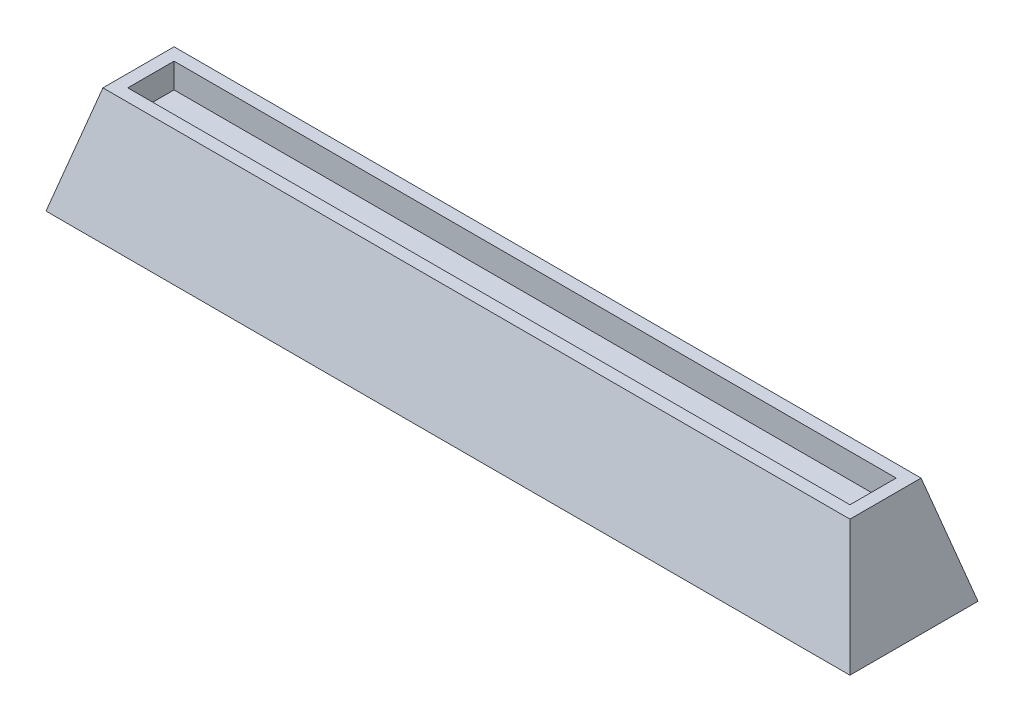
from build123d import *

# Parameters (mm, degrees)
SKETCH_3_W          = 101.5
SKETCH_3_H          = 6.5
CUT_EXTRUDE_1_DEPTH = 3.5
SKETCH_4_W          = 2.906517827
SKETCH_4_H          = 2.452374416
SKETCH_4_W_2        = 2.906517826
SKETCH_4_W_3        = 6.902979839
SKETCH_4_H_2        = 7.084637203
SKETCH_4_W_4        = 2.724860462
SKETCH_4_H_3        = 1.544087595
SKETCH_4_W_5        = 2.724860463
SKETCH_4_H_4        = 1.634916278
CUT_EXTRUDE_2_DEPTH = 1.5


with BuildPart() as part:
    # 草图2 → 放样1 section 0
    with BuildSketch(Plane(origin=(0, -15, 0), x_dir=(1, 0, 0), z_dir=(0, 1, 0))):
        with BuildLine():
            Line((-60.339861751, 19.934331797), (52.660138249, 19.934331797))
            Line((52.660138249, 19.934331797), (52.660138249, 1.934331797))
            Line((52.660138249, 1.934331797), (-60.339861751, 1.934331797))
            Line((-60.339861751, 1.934331797), (-60.339861751, 19.934331797))
        make_face()
    # 草图1 → 放样1 section 1
    with BuildSketch(Plane(origin=(0, 0, 0), x_dir=(1, 0, 0), z_dir=(0, 1, 0))):
        with BuildLine():
            Line((-56.339861751, 15.934331797), (48.660138249, 15.934331797))
            Line((48.660138249, 15.934331797), (48.660138249, 5.934331797))
            Line((48.660138249, 5.934331797), (-56.339861751, 5.934331797))
            Line((-56.339861751, 5.934331797), (-56.339861751, 15.934331797))
        make_face()
    loft()

    # 草图3 → 切除-拉伸1 (cut)
    with BuildSketch(Plane(origin=(0, 0, 0), x_dir=(1, 0, 0), z_dir=(0, 1, 0))):
        with Locations((-3.839861751, 10.934331797)):
            Rectangle(SKETCH_3_W, SKETCH_3_H)
    extrude(amount=-CUT_EXTRUDE_1_DEPTH, mode=Mode.SUBTRACT)

    # 草图4 → 切除-拉伸2 (cut)
    # profile 1 of 17: a face of its own
    with BuildSketch(Plane(origin=(0, 3.967053559, -14.876450848), x_dir=(-1, 0, 0), z_dir=(0, 0.2576626505603324, -0.9662349396012463))):
        Polygon((-29.67592194, -9.348412753), (-25.951945975, -9.348412753), (-25.951945975, -7.259353065), (-25.134487836, -7.259353065), (-25.134487836, -9.348412753), (-21.41051187, -9.348412753), (-21.41051187, -13.799018176), (-22.227970009, -13.799018176), (-22.227970009, -13.254046083), (-25.134487836, -13.254046083), (-25.134487836, -16.796364685), (-25.951945975, -16.796364685), (-25.951945975, -13.254046083), (-28.858463801, -13.254046083), (-28.858463801, -13.799018176), (-29.67592194, -13.799018176), align=None)
        with Locations((-23.681228923, -11.301229418)):
            Rectangle(SKETCH_4_W, SKETCH_4_H, mode=Mode.SUBTRACT)
        with Locations((-27.405204888, -11.301229418)):
            Rectangle(SKETCH_4_W_2, SKETCH_4_H, mode=Mode.SUBTRACT)
    # profile 2 of 17: a face of its own
    with BuildSketch(Plane(origin=(0, 3.967053559, -14.876450848), x_dir=(-1, 0, 0), z_dir=(0, 0.2576626505603324, -0.9662349396012463))):
        Polygon((-19.957252957, -7.804325158), (-11.601014204, -7.804325158), (-11.601014204, -16.614707321), (-12.327643661, -16.614707321), (-12.327643661, -16.16056391), (-19.2306235, -16.16056391), (-19.2306235, -16.614707321), (-19.957252957, -16.614707321), align=None)
        with Locations((-15.779133581, -11.982444534)):
            Rectangle(SKETCH_4_W_3, SKETCH_4_H_2, mode=Mode.SUBTRACT)
    # profile 3 of 17: a face of its own
    with BuildSketch(Plane(origin=(0, 3.967053559, -14.876450848), x_dir=(-1, 0, 0), z_dir=(0, 0.2576626505603324, -0.9662349396012463))):
        Polygon((-18.776480089, -13.889846858), (-16.142448309, -13.889846858), (-16.142448309, -11.982444534), (-18.413165361, -11.982444534), (-18.413165361, -11.346643759), (-16.142448309, -11.346643759), (-16.142448309, -10.07504221), (-18.594822725, -10.07504221), (-18.594822725, -9.439241435), (-12.963444436, -9.439241435), (-12.963444436, -10.07504221), (-15.415818852, -10.07504221), (-15.415818852, -11.346643759), (-13.1451018, -11.346643759), (-13.1451018, -11.982444534), (-15.415818852, -11.982444534), (-15.415818852, -13.889846858), (-12.781787071, -13.889846858), (-12.781787071, -14.525647632), (-18.776480089, -14.525647632), align=None)
    # profile 4 of 17: a face of its own
    with BuildSketch(Plane(origin=(0, 3.967053559, -14.876450848), x_dir=(-1, 0, 0), z_dir=(0, 0.2576626505603324, -0.9662349396012463))):
        with BuildLine():
            Line((-14.961675442, -12.565734977), (-14.43941052, -12.164101898))
            add(Edge.make_bspline(
                [(-14.43941052, -12.164101898), (-14.351443691, -12.253078167), (-14.180171082, -12.42631617), (-13.937666239, -12.686342529), (-13.713991127, -12.936975542), (-13.57556731, -13.104605567), (-13.508416528, -13.185924572)],
                knots=[0, 0, 0, 0, 1.085639139, 2.113754135, 3.084963225, 4, 4, 4, 4], degree=3))
            Line((-13.508416528, -13.185924572), (-14.03068145, -13.617360812))
            add(Edge.make_bspline(
                [(-14.03068145, -13.617360812), (-14.110939355, -13.517017122), (-14.266424604, -13.322619278), (-14.503248709, -13.048206293), (-14.731891605, -12.796468149), (-14.886837014, -12.640882594), (-14.961675442, -12.565734977)],
                knots=[0, 0, 0, 0, 1.097044506, 2.125326337, 3.094535107, 4, 4, 4, 4], degree=3))
        make_face()
    # profile 5 of 17: a face of its own
    with BuildSketch(Plane(origin=(0, 3.967053559, -14.876450848), x_dir=(-1, 0, 0), z_dir=(0, 0.2576626505603324, -0.9662349396012463))):
        Polygon((-10.692727383, -15.343105771), (-7.604552192, -15.343105771), (-7.604552192, -7.441010429), (-6.787094053, -7.441010429), (-6.787094053, -15.343105771), (-5.061349094, -15.343105771), (-5.061349094, -7.441010429), (-4.243890955, -7.441010429), (-4.243890955, -15.343105771), (-1.246544446, -15.343105771), (-1.246544446, -16.069735228), (-10.692727383, -16.069735228), align=None)
    # profile 6 of 17: a face of its own
    with BuildSketch(Plane(origin=(0, 3.967053559, -14.876450848), x_dir=(-1, 0, 0), z_dir=(0, 0.2576626505603324, -0.9662349396012463))):
        with BuildLine():
            add(Edge.make_bspline(
                [(-9.511954516, -9.348412753), (-9.379574416, -9.659799751), (-9.111605353, -10.29012169), (-8.721031097, -11.253707832), (-8.339968954, -12.247642057), (-8.092859406, -12.9216406), (-7.967866921, -13.262561272)],
                knots=[0, 0, 0, 0, 0.964814831, 1.953016539, 2.964598687, 4, 4, 4, 4], degree=3))
            Line((-7.967866921, -13.262561272), (-8.785325059, -13.617360812))
            add(Edge.make_bspline(
                [(-8.785325059, -13.617360812), (-8.895036386, -13.282407054), (-9.114293678, -12.613004396), (-9.469187126, -11.61842817), (-9.841071221, -10.631309602), (-10.106109501, -9.980336431), (-10.238583973, -9.654959555)],
                knots=[0, 0, 0, 0, 1.001847065, 2.002184105, 3.00142875, 4, 4, 4, 4], degree=3))
            Line((-10.238583973, -9.654959555), (-9.511954516, -9.348412753))
        make_face()
    # profile 7 of 17: a face of its own
    with BuildSketch(Plane(origin=(0, 3.967053559, -14.876450848), x_dir=(-1, 0, 0), z_dir=(0, 0.2576626505603324, -0.9662349396012463))):
        with BuildLine():
            add(Edge.make_bspline(
                [(-3.971404909, -13.300879622), (-3.891363397, -13.135573663), (-3.732268647, -12.807002775), (-3.505380424, -12.313062744), (-3.283517141, -11.825124944), (-3.07668777, -11.339466584), (-2.874686702, -10.85995245), (-2.687304914, -10.382583971), (-2.505966974, -9.910535077), (-2.392701005, -9.595559546), (-2.336488631, -9.439241435)],
                knots=[0, 0, 0, 0, 1.050565548, 2.088159765, 3.109163813, 4.11649263, 5.107522664, 6.085386974, 7.049803367, 8, 8, 8, 8], degree=3))
            Line((-2.336488631, -9.439241435), (-1.609859174, -9.745788237))
            add(Edge.make_bspline(
                [(-1.609859174, -9.745788237), (-1.680356565, -9.9304638), (-1.818932898, -10.293479536), (-2.031338929, -10.826098789), (-2.240036194, -11.339156446), (-2.443195009, -11.834167573), (-2.64851267, -12.307206014), (-2.848604455, -12.762043943), (-3.044543099, -13.197672029), (-3.178984281, -13.479461936), (-3.244775452, -13.617360812)],
                knots=[0, 0, 0, 0, 1.128539875, 2.218364625, 3.27359543, 4.290766853, 5.273106292, 6.217546091, 7.127724653, 8, 8, 8, 8], degree=3))
            Line((-3.244775452, -13.617360812), (-3.971404909, -13.300879622))
        make_face()
    # profile 8 of 17: a face of its own
    with BuildSketch(Plane(origin=(0, 3.967053559, -14.876450848), x_dir=(-1, 0, 0), z_dir=(0, 0.2576626505603324, -0.9662349396012463))):
        with BuildLine():
            Line((-0.610743671, -12.436587944), (3.476547023, -12.436587944))
            Line((3.476547023, -12.436587944), (3.476547023, -11.074157713))
            Line((3.476547023, -11.074157713), (1.205829971, -11.074157713))
            Line((1.205829971, -11.074157713), (1.205829971, -10.587372745))
            add(Edge.make_bspline(
                [(1.205829971, -10.587372745), (1.072466882, -10.677100685), (0.802962766, -10.85842559), (0.384886751, -11.118582198), (-0.047589119, -11.375419763), (-0.345288357, -11.537294762), (-0.495788621, -11.619129806)],
                knots=[0, 0, 0, 0, 0.968763999, 1.957707254, 2.967529781, 4, 4, 4, 4], degree=3))
            add(Edge.make_bspline(
                [(-0.495788621, -11.619129806), (-0.530492333, -11.563114504), (-0.60168304, -11.448205501), (-0.71705256, -11.275245328), (-0.841933235, -11.096699574), (-0.92939147, -10.976563681), (-0.9740584, -10.915207519)],
                knots=[0, 0, 0, 0, 0.92881088, 1.90534957, 2.930213894, 4, 4, 4, 4], degree=3))
            add(Edge.make_bspline(
                [(-0.9740584, -10.915207519), (-0.852118313, -10.85345241), (-0.610431587, -10.731053037), (-0.257304362, -10.53691347), (0.085870674, -10.340631088), (0.417318673, -10.13882583), (0.736400325, -9.9314758), (1.044594206, -9.720114929), (1.341290534, -9.504282426), (1.627221136, -9.284429132), (1.90082702, -9.058608588), (2.163635494, -8.828751338), (2.414961964, -8.5944676), (2.655381091, -8.35588172), (2.883799827, -8.112288084), (3.099377004, -7.862759145), (3.306503913, -7.610845029), (3.435171392, -7.436843273), (3.499254193, -7.350181747)],
                knots=[0, 0, 0, 0, 1.135989573, 2.251545074, 3.348852318, 4.42171079, 5.476315166, 6.511306265, 7.527416438, 8.525419603, 9.508627931, 10.475497134, 11.426933218, 12.363886959, 13.290220496, 14.201613547, 15.104314129, 16, 16, 16, 16], degree=3))
            Line((3.499254193, -7.350181747), (4.498369696, -7.350181747))
            Line((4.498369696, -7.350181747), (4.306777945, -7.588607038))
            add(Edge.make_bspline(
                [(4.306777945, -7.588607038), (4.374380606, -7.674179685), (4.50938844, -7.845074995), (4.72094861, -8.093556794), (4.941015465, -8.333619242), (5.170079629, -8.565148986), (5.407248408, -8.789464538), (5.652462196, -9.006792144), (5.906626187, -9.215003023), (6.168565934, -9.416084103), (6.439137729, -9.608320402), (6.717596344, -9.793437338), (7.004896948, -9.969239004), (7.300204, -10.138229931), (7.603494955, -10.299782106), (7.915093546, -10.453789183), (8.235539323, -10.598029605), (8.453438196, -10.688220569), (8.56295322, -10.733550155)],
                knots=[0, 0, 0, 0, 0.977128783, 1.95140307, 2.923461668, 3.894632574, 4.869155811, 5.848140142, 6.829983577, 7.812622778, 8.806534691, 9.803506232, 10.808233629, 11.824032859, 12.85185151, 13.886925924, 14.937978175, 16, 16, 16, 16], degree=3))
            add(Edge.make_bspline(
                [(8.56295322, -10.733550155), (8.514910173, -10.796271286), (8.421583686, -10.918110827), (8.289897743, -11.098948018), (8.167267262, -11.269973385), (8.091508608, -11.382882395), (8.054880279, -11.437472441)],
                knots=[0, 0, 0, 0, 1.091846183, 2.120976395, 3.091516394, 4, 4, 4, 4], degree=3))
            add(Edge.make_bspline(
                [(8.054880279, -11.437472441), (7.916596423, -11.369115003), (7.641618572, -11.233186039), (7.242057812, -11.009271736), (6.850425592, -10.780292949), (6.59902065, -10.614527419), (6.473893532, -10.532024017)],
                knots=[0, 0, 0, 0, 1.015060181, 2.018450131, 3.013759947, 4, 4, 4, 4], degree=3))
            Line((6.473893532, -10.532024017), (6.473893532, -11.074157713))
            Line((6.473893532, -11.074157713), (4.20317648, -11.074157713))
            Line((4.20317648, -11.074157713), (4.20317648, -12.436587944))
            Line((4.20317648, -12.436587944), (8.199638491, -12.436587944))
            Line((8.199638491, -12.436587944), (8.199638491, -13.163217401))
            Line((8.199638491, -13.163217401), (4.20317648, -13.163217401))
            Line((4.20317648, -13.163217401), (4.20317648, -15.381424122))
            add(Edge.make_bspline(
                [(4.20317648, -15.381424122), (4.202684622, -15.434930108), (4.201729063, -15.538879308), (4.185084829, -15.689093638), (4.161769704, -15.829251485), (4.12774199, -15.959014695), (4.083771313, -16.078889906), (4.030170716, -16.188733179), (3.965573188, -16.287672113), (3.891816489, -16.375937953), (3.807802387, -16.453964876), (3.714545043, -16.521849196), (3.610585133, -16.579327924), (3.497235184, -16.625881426), (3.373846924, -16.66119381), (3.241324465, -16.686441831), (3.098943913, -16.702229334), (3.000684942, -16.704411117), (2.950024506, -16.705536003)],
                knots=[0, 0, 0, 0, 1.227352726, 2.384449713, 3.4643955, 4.486231671, 5.458405424, 6.390714832, 7.285141784, 8.163743981, 9.024178394, 9.910262741, 10.804557878, 11.744172713, 12.716588964, 13.745094855, 14.837414293, 16, 16, 16, 16], degree=3))
            add(Edge.make_bspline(
                [(2.950024506, -16.705536003), (2.871022148, -16.705119399), (2.701187433, -16.704223808), (2.427269738, -16.701516739), (2.116458095, -16.695732107), (1.896502947, -16.69006992), (1.780605224, -16.687086427)],
                knots=[0, 0, 0, 0, 0.810572924, 1.742522951, 2.810500907, 4, 4, 4, 4], degree=3))
            add(Edge.make_bspline(
                [(1.780605224, -16.687086427), (1.763212843, -16.560216149), (1.726880165, -16.295184186), (1.682900215, -16.031311834), (1.659973381, -15.893754656)],
                knots=[0, 0, 0, 0, 0.957396055, 2, 2, 2, 2], degree=3))
            add(Edge.make_bspline(
                [(1.659973381, -15.893754656), (1.772523409, -15.90552836), (1.987056532, -15.927970374), (2.294131283, -15.953487078), (2.570442901, -15.971466825), (2.744693492, -15.976528591), (2.826554267, -15.978906546)],
                knots=[0, 0, 0, 0, 1.160595432, 2.212226569, 3.160126127, 4, 4, 4, 4], degree=3))
            add(Edge.make_bspline(
                [(2.826554267, -15.978906546), (2.877312508, -15.978862172), (2.973164862, -15.978778376), (3.108028363, -15.950401355), (3.223706806, -15.899093547), (3.318584893, -15.823419138), (3.39158125, -15.725040017), (3.440764791, -15.604052244), (3.472235946, -15.462499145), (3.475054233, -15.360325789), (3.476547023, -15.306206619)],
                knots=[0, 0, 0, 0, 1.126147397, 2.126627605, 3.039704736, 3.915179211, 4.794435995, 5.732137162, 6.798758716, 8, 8, 8, 8], degree=3))
            Line((3.476547023, -15.306206619), (3.476547023, -13.163217401))
            Line((3.476547023, -13.163217401), (-0.610743671, -13.163217401))
            Line((-0.610743671, -13.163217401), (-0.610743671, -12.436587944))
        make_face()
        with BuildLine():
            add(Edge.make_bspline(
                [(3.844119346, -8.150609508), (3.767393166, -8.248291757), (3.612777925, -8.44513675), (3.362971897, -8.730087185), (3.098899256, -9.011304291), (2.819011285, -9.288625688), (2.522172288, -9.560182466), (2.210908661, -9.829271946), (1.883645205, -10.093346842), (1.655844167, -10.26221652), (1.540760736, -10.347528256)],
                knots=[0, 0, 0, 0, 0.933290205, 1.88072559, 2.846485345, 3.831896886, 4.84082498, 5.869212857, 6.923541795, 8, 8, 8, 8], degree=3))
            Line((1.540760736, -10.347528256), (6.20566508, -10.347528256))
            add(Edge.make_bspline(
                [(6.20566508, -10.347528256), (6.096321706, -10.268300279), (5.877842537, -10.109994731), (5.560268649, -9.859972401), (5.251942278, -9.599792393), (4.952305026, -9.330032308), (4.661266519, -9.050252172), (4.378802299, -8.760938773), (4.105680228, -8.4612789), (3.931436853, -8.254321028), (3.844119346, -8.150609508)],
                knots=[0, 0, 0, 0, 1.001789031, 2.00167625, 2.99802102, 3.994631601, 4.992557832, 5.992845409, 6.994167015, 8, 8, 8, 8], degree=3))
        make_face(mode=Mode.SUBTRACT)
    # profile 9 of 17: a face of its own
    with BuildSketch(Plane(origin=(0, 3.967053559, -14.876450848), x_dir=(-1, 0, 0), z_dir=(0, 0.2576626505603324, -0.9662349396012463))):
        with BuildLine():
            add(Edge.make_bspline(
                [(5.815385587, -13.526532129), (5.938862164, -13.623501628), (6.181803574, -13.814290093), (6.539741663, -14.095628515), (6.881236433, -14.371747447), (7.210263915, -14.638066064), (7.522817305, -14.899588304), (7.822928812, -15.151364127), (8.106556929, -15.397784966), (8.290989117, -15.559241982), (8.381295856, -15.638298988)],
                knots=[0, 0, 0, 0, 1.133684491, 2.230535663, 3.287358962, 4.304735904, 5.287055296, 6.230028982, 7.133338319, 8, 8, 8, 8], degree=3))
            Line((8.381295856, -15.638298988), (7.786651828, -16.251392592))
            add(Edge.make_bspline(
                [(7.786651828, -16.251392592), (7.588871284, -16.062140701), (7.191443714, -15.681850924), (6.575836834, -15.126380283), (5.943579431, -14.577983603), (5.510582907, -14.221936485), (5.293120665, -14.043120259)],
                knots=[0, 0, 0, 0, 0.985869783, 1.981043355, 2.986026876, 4, 4, 4, 4], degree=3))
            Line((5.293120665, -14.043120259), (5.815385587, -13.526532129))
        make_face()
    # profile 10 of 17: a face of its own
    with BuildSketch(Plane(origin=(0, 3.967053559, -14.876450848), x_dir=(-1, 0, 0), z_dir=(0, 0.2576626505603324, -0.9662349396012463))):
        with BuildLine():
            Line((1.410194505, -13.526532129), (2.114116791, -13.986352333))
            add(Edge.make_bspline(
                [(2.114116791, -13.986352333), (2.018107757, -14.10267382), (1.829006006, -14.331783479), (1.541343568, -14.66275273), (1.261706374, -14.981404826), (0.983282975, -15.282676506), (0.711160558, -15.570716771), (0.440291619, -15.841138111), (0.177282716, -16.099643124), (-0.000942309, -16.262320948), (-0.088478749, -16.342221274)],
                knots=[0, 0, 0, 0, 1.121341188, 2.20862114, 3.26015554, 4.273276354, 5.258470736, 6.206048331, 7.118888363, 8, 8, 8, 8], degree=3))
            add(Edge.make_bspline(
                [(-0.088478749, -16.342221274), (-0.133288232, -16.300920383), (-0.225906794, -16.215553874), (-0.372503698, -16.085727436), (-0.532742091, -15.951805367), (-0.644230542, -15.86098907), (-0.701572353, -15.81427956)],
                knots=[0, 0, 0, 0, 0.903625771, 1.867741226, 2.903316182, 4, 4, 4, 4], degree=3))
            add(Edge.make_bspline(
                [(-0.701572353, -15.81427956), (-0.602978709, -15.732265055), (-0.405512702, -15.568004197), (-0.121104871, -15.307416049), (0.156500481, -15.03786188), (0.424238409, -14.756531789), (0.684708381, -14.465485258), (0.935290826, -14.162877623), (1.179178847, -13.850796126), (1.332933104, -13.634979717), (1.410194505, -13.526532129)],
                knots=[0, 0, 0, 0, 0.985364262, 1.973514087, 2.963234022, 3.95828044, 4.957230328, 5.96398113, 6.976902013, 8, 8, 8, 8], degree=3))
        make_face()
    # profile 11 of 17: a face of its own
    with BuildSketch(Plane(origin=(0, 3.967053559, -14.876450848), x_dir=(-1, 0, 0), z_dir=(0, 0.2576626505603324, -0.9662349396012463))):
        with BuildLine():
            Line((8.926267948, -11.074157713), (12.731138209, -11.074157713))
            add(Edge.make_bspline(
                [(12.731138209, -11.074157713), (12.768634038, -10.899965192), (12.845392662, -10.543371448), (12.924297554, -9.988999279), (12.986231399, -9.406349046), (13.004310141, -9.007486095), (13.013558642, -8.803440661)],
                knots=[0, 0, 0, 0, 0.932822433, 1.909603482, 2.930620497, 4, 4, 4, 4], degree=3))
            Line((13.013558642, -8.803440661), (9.743726087, -8.803440661))
            Line((9.743726087, -8.803440661), (9.743726087, -8.076811204))
            Line((9.743726087, -8.076811204), (17.554992747, -8.076811204))
            Line((17.554992747, -8.076811204), (17.554992747, -8.803440661))
            Line((17.554992747, -8.803440661), (13.831016781, -8.803440661))
            add(Edge.make_bspline(
                [(13.831016781, -8.803440661), (13.817032888, -9.007480065), (13.789702054, -9.406265082), (13.722272387, -9.988610505), (13.644651589, -10.542710993), (13.573419229, -10.899879941), (13.538661961, -11.074157713)],
                knots=[0, 0, 0, 0, 1.070909683, 2.093040506, 3.069514149, 4, 4, 4, 4], degree=3))
            Line((13.538661961, -11.074157713), (18.281622204, -11.074157713))
            Line((18.281622204, -11.074157713), (18.281622204, -11.80078717))
            Line((18.281622204, -11.80078717), (13.376873371, -11.80078717))
            add(Edge.make_bspline(
                [(13.376873371, -11.80078717), (13.344184733, -11.933615007), (13.279275221, -12.197369963), (13.158234315, -12.584309314), (13.015962116, -12.95936647), (12.854032566, -13.323327093), (12.672109209, -13.675904579), (12.47012685, -14.0169875), (12.248967389, -14.346788582), (12.005652667, -14.663871095), (11.74570316, -14.972669079), (11.461928738, -15.267037726), (11.160761523, -15.55238335), (10.837989233, -15.823897316), (10.49676258, -16.086295915), (10.134234871, -16.335344787), (9.752526054, -16.574814232), (9.486623688, -16.721907832), (9.352027396, -16.796364685)],
                knots=[0, 0, 0, 0, 0.990483684, 1.966793896, 2.933966559, 3.894050221, 4.850189207, 5.805566789, 6.763373831, 7.724050241, 8.698772232, 9.684986583, 10.68349586, 11.702074788, 12.738151356, 13.79966023, 14.886216846, 16, 16, 16, 16], degree=3))
            add(Edge.make_bspline(
                [(9.352027396, -16.796364685), (9.315603072, -16.746327272), (9.240776064, -16.643534699), (9.116438826, -16.492547304), (8.981884263, -16.337041091), (8.885072127, -16.235386521), (8.835439266, -16.183271081)],
                knots=[0, 0, 0, 0, 0.925364573, 1.9009897, 2.923896413, 4, 4, 4, 4], degree=3))
            add(Edge.make_bspline(
                [(8.835439266, -16.183271081), (8.952441845, -16.12244091), (9.184639831, -16.001720126), (9.518295284, -15.802501516), (9.837976222, -15.593499143), (10.14136665, -15.372584325), (10.429178763, -15.13881357), (10.701126516, -14.893955821), (10.957844622, -14.637181812), (11.199189982, -14.369605645), (11.423937226, -14.088513728), (11.633860179, -13.797055837), (11.82739513, -13.492950193), (12.006640594, -13.178523821), (12.168234464, -12.850482366), (12.315870754, -12.512183682), (12.447223285, -12.161472662), (12.521773417, -11.921801709), (12.559415232, -11.80078717)],
                knots=[0, 0, 0, 0, 1.068024082, 2.119551923, 3.146271105, 4.161100259, 5.158178314, 6.148554749, 7.124043636, 8.098184273, 9.06591214, 10.037932477, 11.006358122, 11.984552947, 12.968256749, 13.967078534, 14.9735383, 16, 16, 16, 16], degree=3))
            Line((12.559415232, -11.80078717), (8.926267948, -11.80078717))
            Line((8.926267948, -11.80078717), (8.926267948, -11.074157713))
        make_face()
    # profile 12 of 17: a face of its own
    with BuildSketch(Plane(origin=(0, 3.967053559, -14.876450848), x_dir=(-1, 0, 0), z_dir=(0, 0.2576626505603324, -0.9662349396012463))):
        with BuildLine():
            Line((13.921845463, -12.527416626), (14.64847492, -12.527416626))
            Line((14.64847492, -12.527416626), (14.64847492, -15.042235762))
            add(Edge.make_bspline(
                [(14.64847492, -15.042235762), (14.650501159, -15.101527042), (14.654313673, -15.213087838), (14.686247439, -15.369130432), (14.741769274, -15.502113559), (14.821130767, -15.61157576), (14.924270452, -15.696623908), (15.049748354, -15.756651083), (15.197214775, -15.792009081), (15.302519244, -15.795439447), (15.358073999, -15.797249182)],
                knots=[0, 0, 0, 0, 1.197767388, 2.253685258, 3.200428474, 4.089799356, 4.959100012, 5.874313874, 6.878566374, 8, 8, 8, 8], degree=3))
            Line((15.358073999, -15.797249182), (16.689281871, -15.797249182))
            add(Edge.make_bspline(
                [(16.689281871, -15.797249182), (16.741460392, -15.795936214), (16.840920565, -15.793433499), (16.981031455, -15.766060695), (17.104316208, -15.722992931), (17.209235408, -15.65914278), (17.295972566, -15.576953895), (17.363682382, -15.476621205), (17.412827027, -15.358780782), (17.429755289, -15.273041587), (17.438618498, -15.22815072)],
                knots=[0, 0, 0, 0, 1.198281355, 2.284105936, 3.268245945, 4.186073337, 5.086264201, 5.994372002, 6.949904073, 8, 8, 8, 8], degree=3))
            add(Edge.make_bspline(
                [(17.438618498, -15.22815072), (17.451612856, -15.129830522), (17.479423841, -14.919402161), (17.508546528, -14.582191546), (17.536337117, -14.20423844), (17.548566034, -13.938613275), (17.554992747, -13.799018176)],
                knots=[0, 0, 0, 0, 0.829604539, 1.775548923, 2.830974967, 4, 4, 4, 4], degree=3))
            add(Edge.make_bspline(
                [(17.554992747, -13.799018176), (17.68492521, -13.844904283), (17.956344477, -13.940756953), (18.229867451, -14.030433811), (18.372450886, -14.077181015)],
                knots=[0, 0, 0, 0, 0.957429923, 2, 2, 2, 2], degree=3))
            add(Edge.make_bspline(
                [(18.372450886, -14.077181015), (18.364361664, -14.152866195), (18.348688464, -14.299509344), (18.326749447, -14.51205562), (18.303087239, -14.709633332), (18.28324217, -14.893009591), (18.258946603, -15.061513142), (18.240118496, -15.216464926), (18.220424429, -15.356541098), (18.206072056, -15.444836753), (18.19930871, -15.486444785)],
                knots=[0, 0, 0, 0, 1.28643749, 2.492525535, 3.611201019, 4.649535074, 5.609529031, 6.488168247, 7.287571473, 8, 8, 8, 8], degree=3))
            add(Edge.make_bspline(
                [(18.19930871, -15.486444785), (18.193390786, -15.524898921), (18.181884675, -15.599664594), (18.153114737, -15.707693282), (18.114839926, -15.807714869), (18.06917235, -15.901059586), (18.01561818, -15.98722086), (17.95015246, -16.063955317), (17.87843709, -16.135474466), (17.796376178, -16.197994791), (17.706538405, -16.253606607), (17.608028657, -16.30170801), (17.501416459, -16.343320715), (17.38508295, -16.375097361), (17.261155126, -16.402451302), (17.127820994, -16.420817458), (16.986024936, -16.429976015), (16.888454179, -16.432006289), (16.838297677, -16.433049956)],
                knots=[0, 0, 0, 0, 1.012620924, 1.968820315, 2.904566024, 3.797066022, 4.671964128, 5.537883318, 6.417710954, 7.304753228, 8.217512198, 9.16510275, 10.155678719, 11.192951675, 12.301989726, 13.458780948, 14.693679725, 16, 16, 16, 16], degree=3))
            Line((16.838297677, -16.433049956), (15.177835833, -16.433049956))
            add(Edge.make_bspline(
                [(15.177835833, -16.433049956), (15.127186587, -16.431777353), (15.028998714, -16.429310303), (14.88605201, -16.415498259), (14.752715294, -16.39080751), (14.629776745, -16.352681585), (14.515877402, -16.308462461), (14.411976604, -16.252186812), (14.318148659, -16.185391395), (14.233714246, -16.108227779), (14.159461302, -16.020920309), (14.094868443, -15.923383455), (14.041222934, -15.814958647), (13.997544973, -15.69688565), (13.96301811, -15.569142365), (13.939976685, -15.430794703), (13.923328474, -15.282482452), (13.922348047, -15.179948343), (13.921845463, -15.127387651)],
                knots=[0, 0, 0, 0, 1.169640996, 2.267448613, 3.312922739, 4.294345508, 5.235551176, 6.130019456, 7.015100252, 7.888782935, 8.764375607, 9.655100766, 10.583284923, 11.551117822, 12.558045693, 13.63378402, 14.787038292, 16, 16, 16, 16], degree=3))
            Line((13.921845463, -15.127387651), (13.921845463, -12.527416626))
        make_face()
    # profile 13 of 17: a face of its own
    with BuildSketch(Plane(origin=(0, 3.967053559, -14.876450848), x_dir=(-1, 0, 0), z_dir=(0, 0.2576626505603324, -0.9662349396012463))):
        with BuildLine():
            add(Edge.make_bspline(
                [(21.551454759, -16.001613716), (21.701682434, -15.946490472), (21.998630443, -15.837530936), (22.433843012, -15.664017205), (22.854911109, -15.486106105), (23.258876173, -15.29814233), (23.648030073, -15.105375278), (24.021782667, -14.906757277), (24.380351013, -14.701235344), (24.610775249, -14.556233294), (24.724781839, -14.484490886)],
                knots=[0, 0, 0, 0, 1.089511314, 2.153585984, 3.189795193, 4.201468757, 5.186765424, 6.146441618, 7.082918204, 8, 8, 8, 8], degree=3))
            add(Edge.make_bspline(
                [(24.724781839, -14.484490886), (24.697525516, -14.409378394), (24.642203286, -14.256922376), (24.563275768, -14.0222804), (24.491761275, -13.7767034), (24.423524458, -13.521201454), (24.35969246, -13.255247439), (24.300077168, -12.979463561), (24.246464906, -12.692945222), (24.2135795, -12.498609719), (24.196840125, -12.399688792)],
                knots=[0, 0, 0, 0, 0.890201545, 1.806844378, 2.757404279, 3.739213768, 4.752898963, 5.804180338, 6.882280829, 8, 8, 8, 8], degree=3))
            Line((24.196840125, -12.399688792), (22.121972418, -12.709073991))
            Line((22.121972418, -12.709073991), (22.005598169, -11.982444534))
            Line((22.005598169, -11.982444534), (24.094657857, -11.707120091))
            add(Edge.make_bspline(
                [(24.094657857, -11.707120091), (24.081224203, -11.591757491), (24.053948165, -11.357522302), (24.024813846, -10.999040168), (23.994585282, -10.629775517), (23.981878396, -10.379267856), (23.975445212, -10.25244198)],
                knots=[0, 0, 0, 0, 0.954624041, 1.938293199, 2.956208477, 4, 4, 4, 4], degree=3))
            Line((23.975445212, -10.25244198), (22.2128011, -10.438356938))
            Line((22.2128011, -10.438356938), (22.096426851, -9.711727482))
            Line((22.096426851, -9.711727482), (23.937126862, -9.542842901))
            add(Edge.make_bspline(
                [(23.937126862, -9.542842901), (23.928553576, -9.377746194), (23.910818952, -9.03622858), (23.884445692, -8.505993812), (23.862825391, -7.940113198), (23.848170883, -7.550762005), (23.840621387, -7.350181747)],
                knots=[0, 0, 0, 0, 0.903871367, 1.869740465, 2.902564022, 4, 4, 4, 4], degree=3))
            Line((23.840621387, -7.350181747), (24.669433111, -7.350181747))
            add(Edge.make_bspline(
                [(24.669433111, -7.350181747), (24.673577062, -7.54177576), (24.681630003, -7.914100429), (24.695244182, -8.456746069), (24.712956338, -8.967138565), (24.72475415, -9.296849763), (24.730458632, -9.456271813)],
                knots=[0, 0, 0, 0, 1.091439789, 2.120995074, 3.091463016, 4, 4, 4, 4], degree=3))
            Line((24.730458632, -9.456271813), (27.825729814, -9.166755389))
            Line((27.825729814, -9.166755389), (27.909462505, -9.802556164))
            Line((27.909462505, -9.802556164), (24.760261793, -10.165870892))
            add(Edge.make_bspline(
                [(24.760261793, -10.165870892), (24.76573264, -10.292219991), (24.776496504, -10.540811197), (24.804003469, -10.906780114), (24.83028382, -11.260980478), (24.855637463, -11.492408601), (24.868120853, -11.606357022)],
                knots=[0, 0, 0, 0, 1.050318918, 2.066497096, 3.047999877, 4, 4, 4, 4], degree=3))
            Line((24.868120853, -11.606357022), (28.09821586, -11.164986395))
            Line((28.09821586, -11.164986395), (28.181948551, -11.80078717))
            Line((28.181948551, -11.80078717), (24.958949535, -12.294668129))
            add(Edge.make_bspline(
                [(24.958949535, -12.294668129), (24.986252313, -12.457705449), (25.039171043, -12.773707287), (25.141701018, -13.228735194), (25.252032962, -13.652351475), (25.34340392, -13.919655964), (25.387547379, -14.048797051)],
                knots=[0, 0, 0, 0, 1.096824096, 2.125884002, 3.094570474, 4, 4, 4, 4], degree=3))
            add(Edge.make_bspline(
                [(25.387547379, -14.048797051), (25.467877567, -13.98349791), (25.62756827, -13.853687859), (25.858438326, -13.652476843), (26.079377252, -13.446895339), (26.287007405, -13.23424264), (26.488546705, -13.020967195), (26.676610114, -12.800158653), (26.856267945, -12.576333592), (26.968185946, -12.422377014), (27.023882855, -12.345759262)],
                knots=[0, 0, 0, 0, 1.048434402, 2.084213046, 3.10116988, 4.104033203, 5.093901699, 6.072481034, 7.040754405, 8, 8, 8, 8], degree=3))
            Line((27.023882855, -12.345759262), (27.636976459, -12.815513852))
            add(Edge.make_bspline(
                [(27.636976459, -12.815513852), (27.566540225, -12.901578395), (27.425410755, -13.074021506), (27.2040137, -13.325019396), (26.9735102, -13.568777155), (26.736456242, -13.808305753), (26.489307047, -14.04058864), (26.234218711, -14.267253856), (25.971191031, -14.48855504), (25.789661272, -14.629376028), (25.698351776, -14.700209006)],
                knots=[0, 0, 0, 0, 0.984755565, 1.973104232, 2.962898897, 3.95521678, 4.95685472, 5.965719756, 6.976756731, 8, 8, 8, 8], degree=3))
            add(Edge.make_bspline(
                [(25.698351776, -14.700209006), (25.728566122, -14.753510843), (25.787968372, -14.858303747), (25.884758417, -15.007460806), (25.98602362, -15.146892116), (26.09009546, -15.277649653), (26.200470338, -15.397235813), (26.314210217, -15.508549783), (26.43225145, -15.610701188), (26.515834101, -15.671046614), (26.556966661, -15.700743707)],
                knots=[0, 0, 0, 0, 1.105385941, 2.173219707, 3.206230935, 4.214071284, 5.186776693, 6.140532586, 7.084921898, 8, 8, 8, 8], degree=3))
            add(Edge.make_bspline(
                [(26.556966661, -15.700743707), (26.605285537, -15.727675108), (26.694205354, -15.777236179), (26.830358152, -15.819914253), (26.954816676, -15.826431181), (27.066915799, -15.795850979), (27.163825863, -15.727434783), (27.241972651, -15.622495666), (27.306990686, -15.485405079), (27.335097312, -15.380158371), (27.350298431, -15.323236997)],
                knots=[0, 0, 0, 0, 1.205378241, 2.218222401, 3.086205313, 3.890483509, 4.706868667, 5.626163307, 6.716139919, 8, 8, 8, 8], degree=3))
            add(Edge.make_bspline(
                [(27.350298431, -15.323236997), (27.370430935, -15.219763166), (27.411688408, -15.007714598), (27.460766911, -14.679769346), (27.509197187, -14.336108654), (27.533646662, -14.100925588), (27.546147777, -13.98067554)],
                knots=[0, 0, 0, 0, 0.931875733, 1.909689759, 2.931215965, 4, 4, 4, 4], degree=3))
            add(Edge.make_bspline(
                [(27.546147777, -13.98067554), (27.615619096, -14.010167827), (27.748000184, -14.06636686), (27.937933701, -14.144019989), (28.110872412, -14.206643891), (28.221097747, -14.241211875), (28.272777234, -14.257419181)],
                knots=[0, 0, 0, 0, 1.164132714, 2.218313358, 3.164650751, 4, 4, 4, 4], degree=3))
            add(Edge.make_bspline(
                [(28.272777234, -14.257419181), (28.259900303, -14.340268218), (28.234922547, -14.500972908), (28.192595081, -14.73336515), (28.154201767, -14.950948831), (28.112098245, -15.152124209), (28.072880026, -15.338257563), (28.033710973, -15.508871663), (27.992192195, -15.663279612), (27.964001157, -15.760862359), (27.950619252, -15.807183569)],
                knots=[0, 0, 0, 0, 1.270279258, 2.463997677, 3.578849156, 4.617652873, 5.577813478, 6.461026064, 7.269469888, 8, 8, 8, 8], degree=3))
            add(Edge.make_bspline(
                [(27.950619252, -15.807183569), (27.926870683, -15.870655863), (27.881382324, -15.992231631), (27.794946018, -16.158415475), (27.695252574, -16.2989859), (27.583612795, -16.415766483), (27.457315761, -16.504422163), (27.319414881, -16.568123426), (27.169438631, -16.608021913), (27.064819684, -16.612439438), (27.011110071, -16.614707321)],
                knots=[0, 0, 0, 0, 1.219069217, 2.335023178, 3.360477963, 4.311848068, 5.228441759, 6.119893237, 7.034784729, 8, 8, 8, 8], degree=3))
            add(Edge.make_bspline(
                [(27.011110071, -16.614707321), (26.953766134, -16.613171076), (26.839381859, -16.610106719), (26.669880493, -16.582233513), (26.504125146, -16.536261114), (26.341758375, -16.473159196), (26.18153287, -16.39405108), (26.027131116, -16.29289764), (25.874330227, -16.17671243), (25.778535101, -16.088073759), (25.729574135, -16.042770463)],
                knots=[0, 0, 0, 0, 0.955164668, 1.905272327, 2.854005057, 3.817431568, 4.804694046, 5.826029766, 6.888882064, 8, 8, 8, 8], degree=3))
            add(Edge.make_bspline(
                [(25.729574135, -16.042770463), (25.665978847, -15.979012082), (25.536339437, -15.849040206), (25.360179199, -15.630424701), (25.192807436, -15.390872803), (25.092586836, -15.219438292), (25.041263029, -15.131645246)],
                knots=[0, 0, 0, 0, 0.942469931, 1.921231122, 2.935445086, 4, 4, 4, 4], degree=3))
            add(Edge.make_bspline(
                [(25.041263029, -15.131645246), (24.928135003, -15.202333252), (24.700497196, -15.344572654), (24.34940376, -15.546918254), (23.988609287, -15.74335907), (23.617175153, -15.931364288), (23.235712808, -16.113380739), (22.844497952, -16.289851961), (22.441770094, -16.456727982), (22.168563626, -16.561838081), (22.031143736, -16.614707321)],
                knots=[0, 0, 0, 0, 0.952335298, 1.916302513, 2.892627957, 3.885021221, 4.888133115, 5.910082319, 6.948794075, 8, 8, 8, 8], degree=3))
            add(Edge.make_bspline(
                [(22.031143736, -16.614707321), (21.999699928, -16.570056987), (21.933062113, -16.475431021), (21.821502397, -16.328594398), (21.692556309, -16.169221854), (21.599903882, -16.059164235), (21.551454759, -16.001613716)],
                knots=[0, 0, 0, 0, 0.841441974, 1.783239965, 2.840828207, 4, 4, 4, 4], degree=3))
        make_face()
    # profile 14 of 17: a face of its own
    with BuildSketch(Plane(origin=(0, 3.967053559, -14.876450848), x_dir=(-1, 0, 0), z_dir=(0, 0.2576626505603324, -0.9662349396012463))):
        with BuildLine():
            add(Edge.make_bspline(
                [(19.929311265, -13.097934286), (20.082649394, -13.076610884), (20.402852625, -13.032083001), (20.901459621, -12.953623634), (21.440736164, -12.871329312), (21.812660049, -12.809348489), (22.005598169, -12.777195502)],
                knots=[0, 0, 0, 0, 0.884220198, 1.846443325, 2.882827389, 4, 4, 4, 4], degree=3))
            add(Edge.make_bspline(
                [(22.005598169, -12.777195502), (21.986828092, -12.895776284), (21.948645746, -13.136994915), (21.926187482, -13.38018487), (21.914769487, -13.503824959)],
                knots=[0, 0, 0, 0, 0.983180951, 2, 2, 2, 2], degree=3))
            add(Edge.make_bspline(
                [(21.914769487, -13.503824959), (21.781820846, -13.525482328), (21.520145818, -13.568109261), (21.13387489, -13.632860531), (20.759297596, -13.692523245), (20.397779353, -13.754867631), (20.048270905, -13.811719633), (19.711832321, -13.871219207), (19.387083585, -13.925724532), (19.174754373, -13.962602459), (19.070696379, -13.98067554)],
                knots=[0, 0, 0, 0, 1.121032794, 2.206463221, 3.259537792, 4.277655831, 5.259526306, 6.206463475, 7.121026209, 8, 8, 8, 8], degree=3))
            Line((19.070696379, -13.98067554), (18.917422978, -13.254046083))
            add(Edge.make_bspline(
                [(18.917422978, -13.254046083), (18.973349932, -13.192574922), (19.089004964, -13.065454659), (19.256726596, -12.858521507), (19.4300537, -12.634327959), (19.607209597, -12.391340285), (19.789154759, -12.129835554), (19.974623697, -11.849218224), (20.163360765, -11.549372113), (20.288246844, -11.342127981), (20.352232316, -11.235946303)],
                knots=[0, 0, 0, 0, 0.803996832, 1.66263799, 2.576393518, 3.545977493, 4.571987434, 5.658742088, 6.800454845, 8, 8, 8, 8], degree=3))
            add(Edge.make_bspline(
                [(20.352232316, -11.235946303), (20.226839412, -11.243066065), (19.980199859, -11.257070168), (19.616095313, -11.28548284), (19.262964685, -11.312352131), (19.031394154, -11.335333237), (18.917422978, -11.346643759)],
                knots=[0, 0, 0, 0, 1.047182188, 2.05973816, 3.04506881, 4, 4, 4, 4], degree=3))
            Line((18.917422978, -11.346643759), (18.735765614, -10.69097421))
            add(Edge.make_bspline(
                [(18.735765614, -10.69097421), (18.810302101, -10.584087927), (18.964413452, -10.363090265), (19.188513619, -10.010765117), (19.411512185, -9.626537691), (19.639541022, -9.213903838), (19.865469788, -8.768420621), (20.095593729, -8.293890039), (20.325330411, -7.787516691), (20.475367163, -7.438437981), (20.552339256, -7.259353065)],
                knots=[0, 0, 0, 0, 0.803835777, 1.662007711, 2.574981022, 3.544144296, 4.570035642, 5.656018271, 6.797486765, 8, 8, 8, 8], degree=3))
            Line((20.552339256, -7.259353065), (21.278968713, -7.546031093))
            add(Edge.make_bspline(
                [(21.278968713, -7.546031093), (21.197660997, -7.704064898), (21.0390094, -8.012428196), (20.806159451, -8.462575561), (20.578617632, -8.884776086), (20.361151664, -9.281771909), (20.153089958, -9.653480901), (19.953022558, -9.99906862), (19.763450008, -10.319859388), (19.635981206, -10.522361426), (19.574511725, -10.620014303)],
                knots=[0, 0, 0, 0, 1.213109084, 2.367077843, 3.459260819, 4.486738305, 5.456813995, 6.366793345, 7.212416185, 8, 8, 8, 8], degree=3))
            add(Edge.make_bspline(
                [(19.574511725, -10.620014303), (19.764219075, -10.613602958), (20.146031252, -10.600699245), (20.527747884, -10.585224377), (20.719804638, -10.577438358)],
                knots=[0, 0, 0, 0, 0.993720792, 2, 2, 2, 2], degree=3))
            add(Edge.make_bspline(
                [(20.719804638, -10.577438358), (20.775052752, -10.466922401), (20.887543123, -10.241901488), (21.052195991, -9.894945756), (21.223803155, -9.536465154), (21.335649943, -9.291352505), (21.392504565, -9.166755389)],
                knots=[0, 0, 0, 0, 0.948611218, 1.931461926, 2.948508455, 4, 4, 4, 4], degree=3))
            Line((21.392504565, -9.166755389), (22.096426851, -9.52013573))
            add(Edge.make_bspline(
                [(22.096426851, -9.52013573), (22.001294668, -9.691626635), (21.814166278, -10.028955347), (21.530769184, -10.522509544), (21.254778719, -10.99896445), (20.980743072, -11.454874893), (20.712547817, -11.892807194), (20.448482547, -12.311455332), (20.189214979, -12.712020377), (20.014844217, -12.970932038), (19.929311265, -13.097934286)],
                knots=[0, 0, 0, 0, 1.124798747, 2.212519157, 3.264262624, 4.28287496, 5.263378643, 6.209630769, 7.121781866, 8, 8, 8, 8], degree=3))
        make_face()
    # profile 15 of 17: a face of its own
    with BuildSketch(Plane(origin=(0, 3.967053559, -14.876450848), x_dir=(-1, 0, 0), z_dir=(0, 0.2576626505603324, -0.9662349396012463))):
        with BuildLine():
            add(Edge.make_bspline(
                [(18.735765614, -15.252277089), (19.295407257, -15.134740972), (20.422323385, -14.898065686), (21.543430255, -14.635242256), (22.107780437, -14.502940462)],
                knots=[0, 0, 0, 0, 0.993226789, 2, 2, 2, 2], degree=3))
            add(Edge.make_bspline(
                [(22.107780437, -14.502940462), (22.099503195, -14.626838157), (22.083339158, -14.868789166), (22.080689366, -15.111261996), (22.079396473, -15.229569919)],
                knots=[0, 0, 0, 0, 1.024155219, 2, 2, 2, 2], degree=3))
            add(Edge.make_bspline(
                [(22.079396473, -15.229569919), (21.554271576, -15.348606502), (20.506792099, -15.586051686), (19.465217093, -15.848186019), (18.945806941, -15.978906546)],
                knots=[0, 0, 0, 0, 1.002644747, 2, 2, 2, 2], degree=3))
            Line((18.945806941, -15.978906546), (18.735765614, -15.252277089))
        make_face()
    # profile 16 of 17: a face of its own
    with BuildSketch(Plane(origin=(0, 3.967053559, -14.876450848), x_dir=(-1, 0, 0), z_dir=(0, 0.2576626505603324, -0.9662349396012463))):
        with BuildLine():
            Line((25.457088089, -7.781617987), (25.868655554, -7.350181747))
            add(Edge.make_bspline(
                [(25.868655554, -7.350181747), (25.980278765, -7.4237901), (26.210036919, -7.575300875), (26.554568167, -7.821294304), (26.912351974, -8.086998086), (27.151137588, -8.275355614), (27.273661731, -8.372004421)],
                knots=[0, 0, 0, 0, 0.923148979, 1.900151446, 2.922539181, 4, 4, 4, 4], degree=3))
            Line((27.273661731, -8.372004421), (26.813841527, -8.894269343))
            add(Edge.make_bspline(
                [(26.813841527, -8.894269343), (26.690395937, -8.785358142), (26.45262293, -8.575580349), (26.101874372, -8.282465006), (25.774717765, -8.018212794), (25.559758809, -7.858094969), (25.457088089, -7.781617987)],
                knots=[0, 0, 0, 0, 1.125402949, 2.167679228, 3.12482971, 4, 4, 4, 4], degree=3))
        make_face()
    # profile 17 of 17: a face of its own
    with BuildSketch(Plane(origin=(0, 3.967053559, -14.876450848), x_dir=(-1, 0, 0), z_dir=(0, 0.2576626505603324, -0.9662349396012463))):
        with BuildLine():
            Line((28.99940669, -8.530954614), (32.541725292, -8.530954614))
            Line((32.541725292, -8.530954614), (32.541725292, -7.259353065))
            Line((32.541725292, -7.259353065), (33.359183431, -7.259353065))
            Line((33.359183431, -7.259353065), (33.359183431, -8.530954614))
            Line((33.359183431, -8.530954614), (36.901502032, -8.530954614))
            Line((36.901502032, -8.530954614), (36.901502032, -13.889846858))
            Line((36.901502032, -13.889846858), (33.359183431, -13.889846858))
            Line((33.359183431, -13.889846858), (33.359183431, -15.023786186))
            add(Edge.make_bspline(
                [(33.359183431, -15.023786186), (33.360886804, -15.070329151), (33.364087212, -15.157777064), (33.392997955, -15.279982902), (33.439316285, -15.385128153), (33.507524771, -15.470811474), (33.595361633, -15.537301329), (33.701776729, -15.58359525), (33.827195688, -15.610137274), (33.916319788, -15.61369695), (33.963761846, -15.615591818)],
                knots=[0, 0, 0, 0, 1.151176019, 2.162903462, 3.090903992, 3.974729871, 4.844147985, 5.793501464, 6.825448662, 8, 8, 8, 8], degree=3))
            Line((33.963761846, -15.615591818), (36.173453377, -15.615591818))
            add(Edge.make_bspline(
                [(36.173453377, -15.615591818), (36.224604739, -15.614222667), (36.321655761, -15.611624936), (36.460144741, -15.592437639), (36.58249098, -15.557321267), (36.689515871, -15.5083652), (36.782458926, -15.447873501), (36.857345758, -15.370005195), (36.919175701, -15.279950836), (36.944119949, -15.21088802), (36.95685076, -15.175640389)],
                knots=[0, 0, 0, 0, 1.267991787, 2.405799099, 3.456168398, 4.411270981, 5.315552574, 6.186359265, 7.074371056, 8, 8, 8, 8], degree=3))
            add(Edge.make_bspline(
                [(36.95685076, -15.175640389), (36.969676974, -15.133678132), (36.99642815, -15.046158952), (37.027538618, -14.90633011), (37.059512004, -14.754211409), (37.087440756, -14.588454319), (37.112355015, -14.409450381), (37.137380851, -14.218030845), (37.156271382, -14.012945985), (37.167954077, -13.871878293), (37.173988078, -13.799018176)],
                knots=[0, 0, 0, 0, 0.753905302, 1.572393376, 2.460608481, 3.425733155, 4.460639005, 5.566991358, 6.743374243, 8, 8, 8, 8], degree=3))
            add(Edge.make_bspline(
                [(37.173988078, -13.799018176), (37.226326111, -13.821216241), (37.340964318, -13.869837604), (37.530854063, -13.938471612), (37.749876768, -14.018383379), (37.907508077, -14.068789501), (37.991446217, -14.095630591)],
                knots=[0, 0, 0, 0, 0.784083252, 1.717410741, 2.784528927, 4, 4, 4, 4], degree=3))
            add(Edge.make_bspline(
                [(37.991446217, -14.095630591), (37.972068293, -14.220600313), (37.934646281, -14.461937749), (37.872625113, -14.809432856), (37.806538139, -15.128944975), (37.75689758, -15.331409366), (37.733152152, -15.428257661)],
                knots=[0, 0, 0, 0, 1.117475817, 2.158032724, 3.118899935, 4, 4, 4, 4], degree=3))
            add(Edge.make_bspline(
                [(37.733152152, -15.428257661), (37.711332874, -15.500546003), (37.669243932, -15.639988734), (37.57031582, -15.829400394), (37.442735334, -15.987804433), (37.291821632, -16.120696197), (37.111829085, -16.219484076), (36.908658246, -16.293015132), (36.678961271, -16.334874867), (36.517542245, -16.339699423), (36.43316664, -16.342221274)],
                knots=[0, 0, 0, 0, 1.044551441, 2.014918318, 2.938149546, 3.848779701, 4.782006105, 5.764688892, 6.831576851, 8, 8, 8, 8], degree=3))
            Line((36.43316664, -16.342221274), (33.889963542, -16.342221274))
            add(Edge.make_bspline(
                [(33.889963542, -16.342221274), (33.835520202, -16.34109545), (33.729714006, -16.338907503), (33.576505429, -16.323095451), (33.433389767, -16.298204638), (33.301297246, -16.261350264), (33.179665189, -16.214207699), (33.067937475, -16.1580063), (32.967973373, -16.088883224), (32.877967469, -16.010367534), (32.797341481, -15.922020964), (32.729457288, -15.821505975), (32.671082472, -15.711569694), (32.622315279, -15.591465052), (32.585822541, -15.460477702), (32.560937157, -15.319272053), (32.544969975, -15.167961031), (32.542831091, -15.06356616), (32.541725292, -15.009594204)],
                knots=[0, 0, 0, 0, 1.201542108, 2.335099194, 3.396067964, 4.404398739, 5.356501036, 6.271819621, 7.158088408, 8.031344083, 8.903725315, 9.789994102, 10.700894582, 11.647138439, 12.645416899, 13.696110575, 14.808893404, 16, 16, 16, 16], degree=3))
            Line((32.541725292, -15.009594204), (32.541725292, -13.889846858))
            Line((32.541725292, -13.889846858), (29.816864829, -13.889846858))
            Line((29.816864829, -13.889846858), (29.816864829, -14.525647632))
            Line((29.816864829, -14.525647632), (28.99940669, -14.525647632))
            Line((28.99940669, -14.525647632), (28.99940669, -8.530954614))
        make_face()
        with Locations((34.721613662, -12.391173604)):
            Rectangle(SKETCH_4_W_4, SKETCH_4_H_3, mode=Mode.SUBTRACT)
        with Locations((31.179295061, -12.391173604)):
            Rectangle(SKETCH_4_W_5, SKETCH_4_H_3, mode=Mode.SUBTRACT)
        with Locations((34.721613662, -10.07504221)):
            Rectangle(SKETCH_4_W_4, SKETCH_4_H_4, mode=Mode.SUBTRACT)
        with Locations((31.179295061, -10.07504221)):
            Rectangle(SKETCH_4_W_5, SKETCH_4_H_4, mode=Mode.SUBTRACT)
    extrude(amount=-CUT_EXTRUDE_2_DEPTH, mode=Mode.SUBTRACT)


solid = part.part
